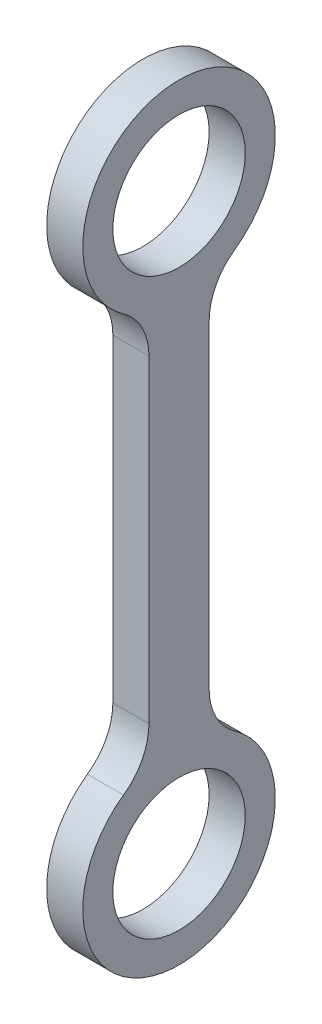
from build123d import *

# Parameters (mm, degrees)
BOSS_EXTRUDE1_DEPTH      = 3
BOSS_EXTRUDE1_DEPTH_BACK = 3
SKETCH1_R                = 11
FILLET1_R                = 10


with BuildPart() as part:
    # Sketch1 → Boss-Extrude1 (new, two sides: drawn at the far end of the back side and taken through both)
    with BuildSketch(Plane(origin=(0, 0, 0), x_dir=(0, 0, -1), z_dir=(1, 0, 0)).offset(-BOSS_EXTRUDE1_DEPTH_BACK)):
        with BuildLine():
            Line((-5, -15.198684154), (-5, -80.198684154))
            ThreePointArc((-5, -80.198684154), (0, -111.397368307), (5, -80.198684154))
            Line((5, -80.198684154), (5, -15.198684154))
            ThreePointArc((5, -15.198684154), (0, 16), (-5, -15.198684154))
        make_face()
        Circle(SKETCH1_R, mode=Mode.SUBTRACT)
        with Locations((0, -95.397368307)):
            Circle(SKETCH1_R, mode=Mode.SUBTRACT)
    extrude(amount=BOSS_EXTRUDE1_DEPTH + BOSS_EXTRUDE1_DEPTH_BACK)

    # Fillet1
    fillet1_edges = [part.edges().sort_by_distance(p)[0] for p in [
        (0, -80.198684154, -5),
        (0, -80.198684154, 5),
        (0, -15.198684154, -5),
        (0, -15.198684154, 5),
    ]]
    fillet(fillet1_edges, radius=FILLET1_R)


solid = part.part
